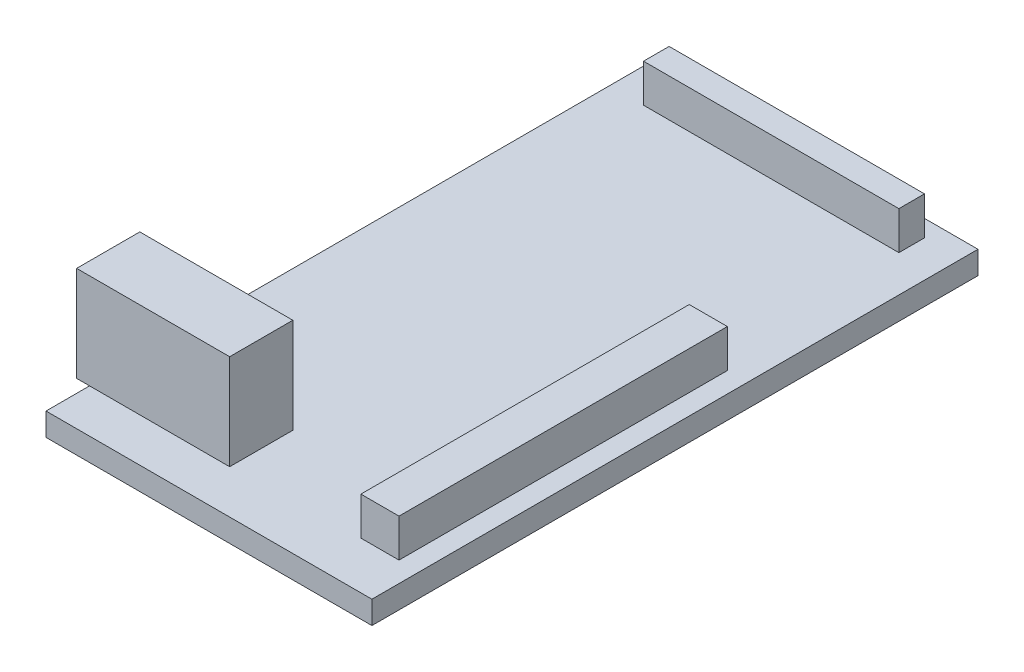
from build123d import *

# Parameters (mm, degrees)
SKETCH1_W           = 17.1
SKETCH1_H           = 31.8
BOSS_EXTRUDE1_DEPTH = 1.2
SKETCH2_W           = 13.399731937
SKETCH2_H           = 1.34283028
SKETCH2_W_2         = 1.999959991
SKETCH2_H_2         = 17.228226777
BOSS_EXTRUDE2_DEPTH = 2
SKETCH3_W           = 8.02841082
SKETCH3_H           = 3.314219413
BOSS_EXTRUDE3_DEPTH = 5


with BuildPart() as part:
    # Sketch1 → Boss-Extrude1 (new body)
    with BuildSketch(Plane(origin=(0, 0, 0), x_dir=(1, 0, 0), z_dir=(0, 1, 0))):
        with Locations((8.55, -15.9)):
            Rectangle(SKETCH1_W, SKETCH1_H)
    extrude(amount=BOSS_EXTRUDE1_DEPTH)

    # Sketch2 → Boss-Extrude2 (add)
    with BuildSketch(Plane(origin=(0, 1.2, 0), x_dir=(1, 0, 0), z_dir=(0, 1, 0))):
        with Locations((8.478572857, -1.557429781)):
            Rectangle(SKETCH2_W, SKETCH2_H)
        with Locations((15.035584542, -20.699903977)):
            Rectangle(SKETCH2_W_2, SKETCH2_H_2)
    extrude(amount=BOSS_EXTRUDE2_DEPTH)

    # Sketch3 → Boss-Extrude3 (add)
    with BuildSketch(Plane(origin=(0, 1.2, 0), x_dir=(1, 0, 0), z_dir=(0, 1, 0))):
        with Locations((3.335818596, -27.856903659)):
            Rectangle(SKETCH3_W, SKETCH3_H)
    extrude(amount=BOSS_EXTRUDE3_DEPTH)


solid = part.part
